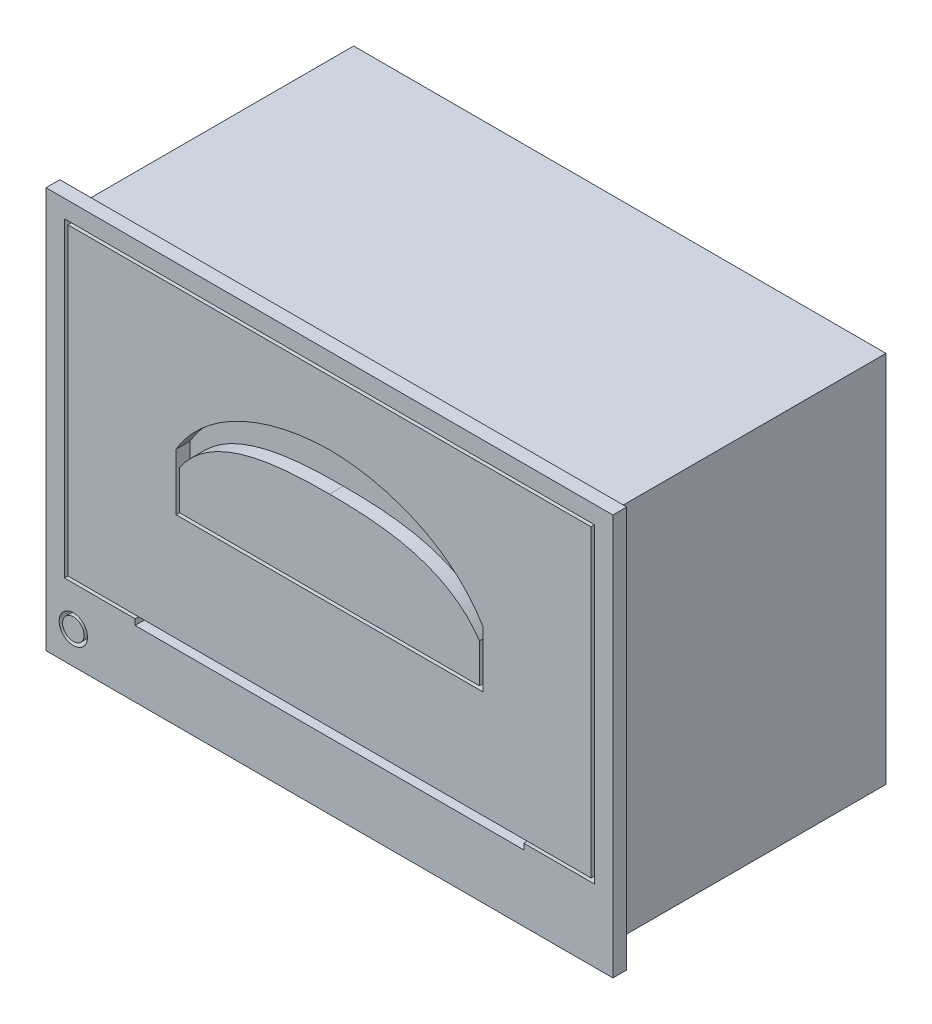
from build123d import *

# Parameters (mm, degrees)
SKETCH_1_W           = 82
SKETCH_1_H           = 58
EXTRUDE_1_DEPTH      = 42
SKETCH_2_OUTSIDE_W   = 105.774
SKETCH_2_OUTSIDE_H   = 81.774
SKETCH_2_OUTSIDE_W_2 = 77
SKETCH_2_OUTSIDE_H_2 = 54
CUT_EXTRUDE_1_DEPTH  = 40
SKETCH_3_R           = 2.051183763
SKETCH_3_R_2         = 1.551183763
SKETCH_3_W           = 76.662993142
SKETCH_3_H           = 44.9978438
SKETCH_3_W_2         = 75.662993142
SKETCH_3_H_2         = 43.9978438
CUT_EXTRUDE_2_DEPTH  = 2
SKETCH_5_W           = 56.22095986
SKETCH_5_H           = 0.839970392
CUT_EXTRUDE_3_DEPTH  = 2


with BuildPart() as part:
    # 草图1 → 凸台-拉伸1 (new body)
    with BuildSketch(Plane.XY):
        Rectangle(SKETCH_1_W, SKETCH_1_H)
    extrude(amount=-EXTRUDE_1_DEPTH)

    # 草图2 outside → 切除-拉伸1 (cut)
    with BuildSketch(Plane(origin=(0, 0, -42), x_dir=(-1, 0, 0), z_dir=(0, 0, -1))):
        Rectangle(SKETCH_2_OUTSIDE_W, SKETCH_2_OUTSIDE_H)
        Rectangle(SKETCH_2_OUTSIDE_W_2, SKETCH_2_OUTSIDE_H_2, mode=Mode.SUBTRACT)
    extrude(amount=-CUT_EXTRUDE_1_DEPTH, mode=Mode.SUBTRACT)

    # 草图3 → 切除-拉伸2 (cut)
    # profile 1 of 2: a face of its own
    with BuildSketch(Plane.XY):
        with Locations((-37.049506719, -24.324267733)):
            Circle(SKETCH_3_R)
        with Locations((-37.049506719, -24.324267733)):
            Circle(SKETCH_3_R_2, mode=Mode.SUBTRACT)
    # profile 2 of 2: a face of its own
    with BuildSketch(Plane.XY):
        with Locations((0, 3.943608501)):
            Rectangle(SKETCH_3_W, SKETCH_3_H)
        with Locations((0, 3.943608501)):
            Rectangle(SKETCH_3_W_2, SKETCH_3_H_2, mode=Mode.SUBTRACT)
    extrude(amount=-CUT_EXTRUDE_2_DEPTH, mode=Mode.SUBTRACT)

    # 草图5 → 切除-拉伸3 (cut)
    # profile 1 of 2: a face of its own
    with BuildSketch(Plane.XY):
        with Locations((0, -18.975298595)):
            Rectangle(SKETCH_5_W, SKETCH_5_H)
    # profile 2 of 2: a face of its own
    with BuildSketch(Plane.XY):
        with BuildLine():
            Line((22.181492686, -2.55676808), (-22.181492686, -2.55676808))
            Line((-22.181492686, -2.55676808), (-22.181492686, 5.66529789))
            add(Edge.make_bspline(
                [(-22.181492686, 5.66529789), (-21.613171528, 6.595019079), (-20.324411635, 8.382514153), (-17.243691235, 11.385794253), (-12.622221003, 14.216373785), (-7.423291418, 15.868320573), (-3.158321809, 16.537625375), (-1.057172799, 16.660943148), (0, 16.672230501)],
                knots=[-0.005481994, -0.005481994, -0.005481994, -0.005481994, 0.120230411, 0.245942817, 0.497367628, 0.748792439, 0.874504845, 1.00021725, 1.00021725, 1.00021725, 1.00021725], degree=3))
            add(Edge.make_bspline(
                [(0, 16.672230501), (1.057172799, 16.660943148), (3.158321809, 16.537625375), (7.423291418, 15.868320573), (12.622221003, 14.216373785), (17.243691235, 11.385794253), (20.324411635, 8.382514153), (21.613171528, 6.595019079), (22.181492686, 5.66529789)],
                knots=[-0.005481994, -0.005481994, -0.005481994, -0.005481994, 0.120230411, 0.245942817, 0.497367628, 0.748792439, 0.874504845, 1.00021725, 1.00021725, 1.00021725, 1.00021725], degree=3))
            Line((22.181492686, 5.66529789), (22.181492686, -2.55676808))
        make_face()
        with BuildLine():
            Line((21.693569538, -2.05676808), (-21.693569538, -2.05676808))
            Line((-21.693569538, -2.05676808), (-21.693569538, 3.576865713))
            add(Edge.make_bspline(
                [(-21.693569538, 3.576865713), (-17.048272024, 10.504797519), (-7.443342261, 11.136498571), (0, 11.122264619)],
                knots=[0, 0, 0, 0, 1, 1, 1, 1], degree=3))
            add(Edge.make_bspline(
                [(21.693569538, 3.576865713), (17.048272024, 10.504797519), (7.443342261, 11.136498571), (0, 11.122264619)],
                knots=[0, 0, 0, 0, 1, 1, 1, 1], degree=3))
            Line((21.693569538, 3.576865713), (21.693569538, -2.05676808))
        make_face(mode=Mode.SUBTRACT)
    extrude(amount=-CUT_EXTRUDE_3_DEPTH, mode=Mode.SUBTRACT)


solid = part.part
